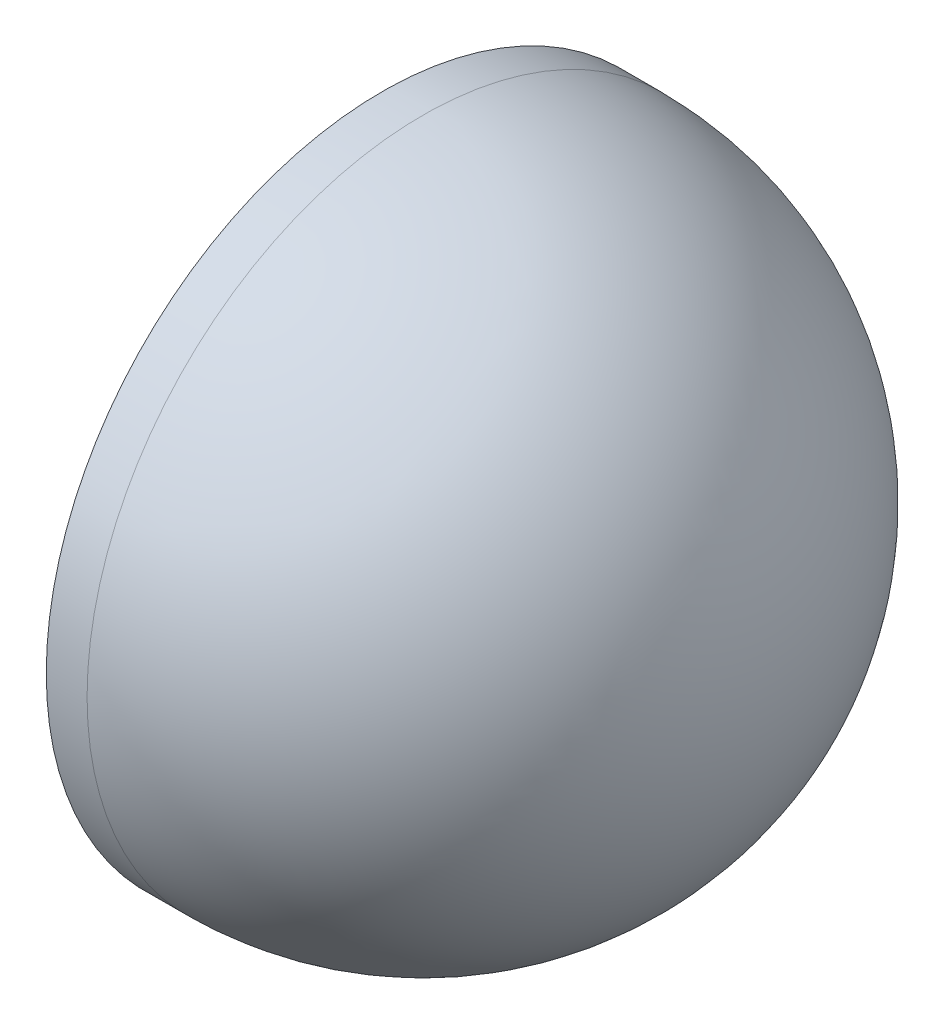
from build123d import *


with BuildPart() as part:
    # Sketch1 → Revolve1 (revolve)
    with BuildSketch(Plane.XY):
        with BuildLine():
            Line((776, 0), (823, 0))
            ThreePointArc((823, 0), (581.948880917, -581.948880917), (0, -823))
            Line((0, -823), (-100, -823))
            Line((-100, -823), (-100, -776))
            Line((-100, -776), (0, -776))
            ThreePointArc((0, -776), (548.714862201, -548.714862201), (776, 0))
        make_face()
    revolve(axis=Axis((0, 0, 0), (1, 0, 0)))


solid = part.part
